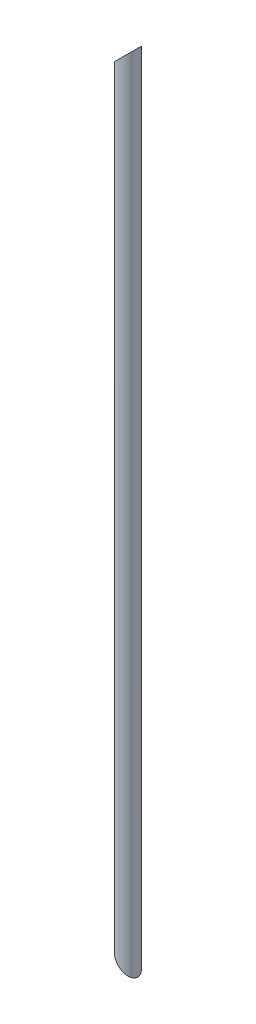
from build123d import *

# Parameters (mm, degrees)
ESBO_O2_W                  = 31.75
ESBO_O2_H                  = 2650
CORTE_EXTRUS_O1_DEPTH      = 2651.380373645
CORTE_EXTRUS_O1_DEPTH_BACK = 2651.380373645
ESBO_O9_R                  = 30.75
CORTE_EXTRUS_O6_DEPTH      = 2651.380373645


with BuildPart() as part:
    # Esboço2 → Revolução2 (revolve)
    with BuildSketch(Plane.XY):
        with Locations((15.875, 1325)):
            Rectangle(ESBO_O2_W, ESBO_O2_H)
    revolve(axis=Axis((0, 0, 0), (0, 1, 0)))

    # Esboço3 → Corte-extrusão1 (cut, two sides: drawn at the far end of the back side and taken through both)
    with BuildSketch(Plane.XY.offset(-CORTE_EXTRUS_O1_DEPTH_BACK)):
        Polygon((-31.75, 2650), (31.75, 2650), (-31.75, 2586.5), align=None)
        Polygon((31.75, 0), (-31.75, 63.5), (-31.75, 0), align=None)
    extrude(amount=CORTE_EXTRUS_O1_DEPTH + CORTE_EXTRUS_O1_DEPTH_BACK, mode=Mode.SUBTRACT)

    # Esboço9 → Corte-extrusão6 (cut, through all)
    with BuildSketch(Plane(origin=(0, 0, 0), x_dir=(1, 0, 0), z_dir=(0, 1, 0))):
        Circle(ESBO_O9_R)
    extrude(amount=CORTE_EXTRUS_O6_DEPTH, mode=Mode.SUBTRACT)


solid = part.part
